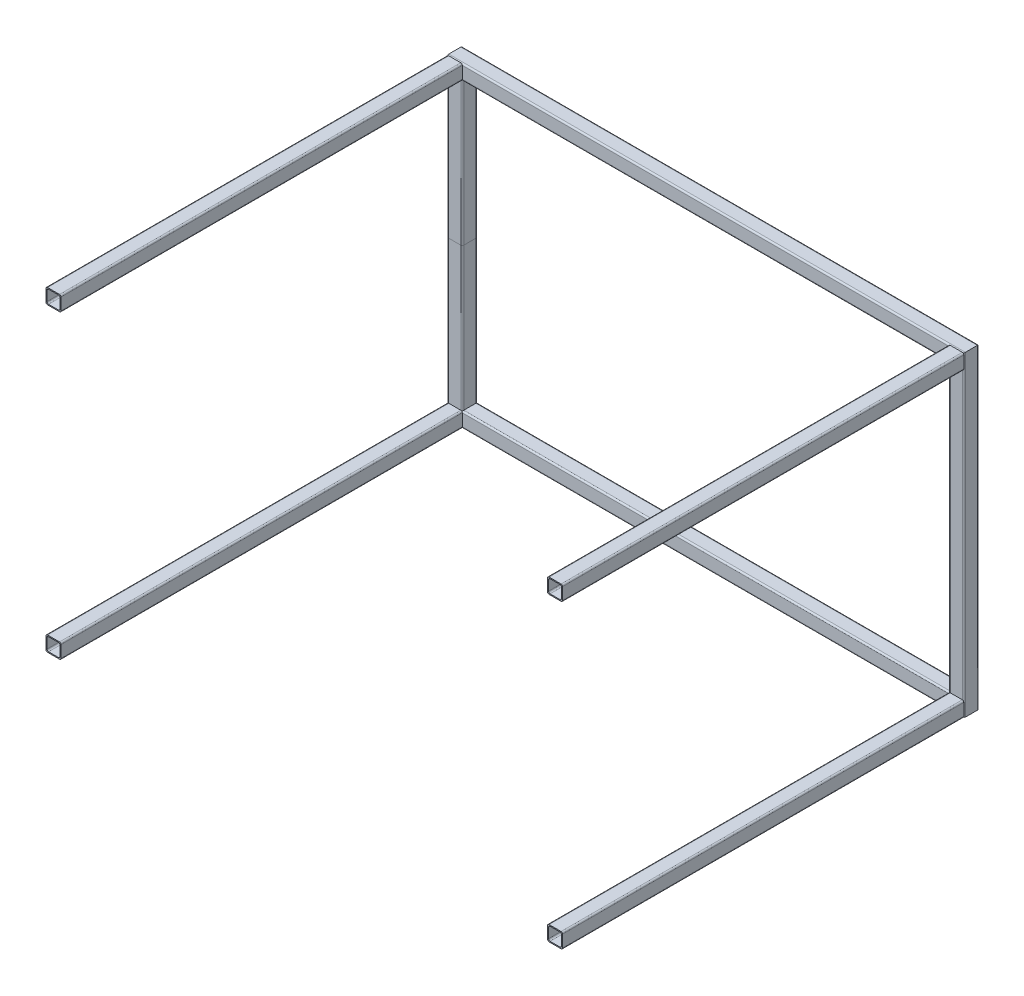
from build123d import *

# Parameters (mm, degrees)
BOSS_EXTRU_1_DEPTH = 800


with BuildPart() as part:
    # Balayage1: sweep along a path in Esquisse1
    with BuildLine(Plane.XY) as balayage1_path:
        Line((-600, -400), (600, -400))
        Line((600, -400), (600, 400))
        Line((600, 400), (-600, 400))
        Line((-600, 400), (-600, -400))
    # Esquisse2 → Balayage1 (sweep)
    with BuildSketch(Plane(origin=(0, 0, 0), x_dir=(1, 0, 0), z_dir=(0, 1, 0))):
        with BuildLine():
            Line((-512, -15), (-488, -15))
            ThreePointArc((-488, -15), (-485.878679656, -14.121320344), (-485, -12))
            Line((-485, -12), (-485, 12))
            ThreePointArc((-485, 12), (-485.878679656, 14.121320344), (-488, 15))
            Line((-488, 15), (-512, 15))
            ThreePointArc((-512, 15), (-514.121320344, 14.121320344), (-515, 12))
            Line((-515, 12), (-515, -12))
            ThreePointArc((-515, -12), (-514.121320344, -14.121320344), (-512, -15))
        make_face()
        with BuildLine():
            Line((-510, -13), (-490, -13))
            ThreePointArc((-490, -13), (-487.878679656, -12.121320344), (-487, -10))
            Line((-487, -10), (-487, 10))
            ThreePointArc((-487, 10), (-487.878679656, 12.121320344), (-490, 13))
            Line((-490, 13), (-510, 13))
            ThreePointArc((-510, 13), (-512.121320344, 12.121320344), (-513, 10))
            Line((-513, 10), (-513, -10))
            ThreePointArc((-513, -10), (-512.121320344, -12.121320344), (-510, -13))
        make_face(mode=Mode.SUBTRACT)
    sweep(path=balayage1_path.line, transition=Transition.RIGHT)

    # Esquisse3 → Boss.-Extru.1 (add)
    # profile 1 of 4: a face of its own
    with BuildSketch(Plane.XY.offset(15)):
        with BuildLine():
            Line((-512, 285), (-488, 285))
            ThreePointArc((-488, 285), (-485.878679656, 285.878679656), (-485, 288))
            Line((-485, 288), (-485, 312))
            ThreePointArc((-485, 312), (-485.878679656, 314.121320344), (-488, 315))
            Line((-488, 315), (-512, 315))
            ThreePointArc((-512, 315), (-514.121320344, 314.121320344), (-515, 312))
            Line((-515, 312), (-515, 288))
            ThreePointArc((-515, 288), (-514.121320344, 285.878679656), (-512, 285))
        make_face()
        with BuildLine():
            Line((-510, 287), (-490, 287))
            ThreePointArc((-490, 287), (-487.878679656, 287.878679656), (-487, 290))
            Line((-487, 290), (-487, 310))
            ThreePointArc((-487, 310), (-487.878679656, 312.121320344), (-490, 313))
            Line((-490, 313), (-510, 313))
            ThreePointArc((-510, 313), (-512.121320344, 312.121320344), (-513, 310))
            Line((-513, 310), (-513, 290))
            ThreePointArc((-513, 290), (-512.121320344, 287.878679656), (-510, 287))
        make_face(mode=Mode.SUBTRACT)
    # profile 2 of 4: a face of its own
    with BuildSketch(Plane.XY.offset(15)):
        with BuildLine():
            Line((485, 288), (485, 312))
            ThreePointArc((485, 312), (485.878679656, 314.121320344), (488, 315))
            Line((488, 315), (512, 315))
            ThreePointArc((512, 315), (514.121320344, 314.121320344), (515, 312))
            Line((515, 312), (515, 288))
            ThreePointArc((515, 288), (514.121320344, 285.878679656), (512, 285))
            Line((512, 285), (488, 285))
            ThreePointArc((488, 285), (485.878679656, 285.878679656), (485, 288))
        make_face()
        with BuildLine():
            Line((487, 290), (487, 310))
            ThreePointArc((487, 310), (487.878679656, 312.121320344), (490, 313))
            Line((490, 313), (510, 313))
            ThreePointArc((510, 313), (512.121320344, 312.121320344), (513, 310))
            Line((513, 310), (513, 290))
            ThreePointArc((513, 290), (512.121320344, 287.878679656), (510, 287))
            Line((510, 287), (490, 287))
            ThreePointArc((490, 287), (487.878679656, 287.878679656), (487, 290))
        make_face(mode=Mode.SUBTRACT)
    # profile 3 of 4: a face of its own
    with BuildSketch(Plane.XY.offset(15)):
        with BuildLine():
            Line((-512, -315), (-488, -315))
            ThreePointArc((-488, -315), (-485.878679656, -314.121320344), (-485, -312))
            Line((-485, -312), (-485, -288))
            ThreePointArc((-485, -288), (-485.878679656, -285.878679656), (-488, -285))
            Line((-488, -285), (-512, -285))
            ThreePointArc((-512, -285), (-514.121320344, -285.878679656), (-515, -288))
            Line((-515, -288), (-515, -312))
            ThreePointArc((-515, -312), (-514.121320344, -314.121320344), (-512, -315))
        make_face()
        with BuildLine():
            Line((-510, -287), (-490, -287))
            ThreePointArc((-490, -287), (-487.878679656, -287.878679656), (-487, -290))
            Line((-487, -290), (-487, -310))
            ThreePointArc((-487, -310), (-487.878679656, -312.121320344), (-490, -313))
            Line((-490, -313), (-510, -313))
            ThreePointArc((-510, -313), (-512.121320344, -312.121320344), (-513, -310))
            Line((-513, -310), (-513, -290))
            ThreePointArc((-513, -290), (-512.121320344, -287.878679656), (-510, -287))
        make_face(mode=Mode.SUBTRACT)
    # profile 4 of 4: a face of its own
    with BuildSketch(Plane.XY.offset(15)):
        with BuildLine():
            Line((512, -285), (488, -285))
            ThreePointArc((488, -285), (485.878679656, -285.878679656), (485, -288))
            Line((485, -288), (485, -312))
            ThreePointArc((485, -312), (485.878679656, -314.121320344), (488, -315))
            Line((488, -315), (512, -315))
            ThreePointArc((512, -315), (514.121320344, -314.121320344), (515, -312))
            Line((515, -312), (515, -288))
            ThreePointArc((515, -288), (514.121320344, -285.878679656), (512, -285))
        make_face()
        with BuildLine():
            Line((510, -287), (490, -287))
            ThreePointArc((490, -287), (487.878679656, -287.878679656), (487, -290))
            Line((487, -290), (487, -310))
            ThreePointArc((487, -310), (487.878679656, -312.121320344), (490, -313))
            Line((490, -313), (510, -313))
            ThreePointArc((510, -313), (512.121320344, -312.121320344), (513, -310))
            Line((513, -310), (513, -290))
            ThreePointArc((513, -290), (512.121320344, -287.878679656), (510, -287))
        make_face(mode=Mode.SUBTRACT)
    extrude(amount=BOSS_EXTRU_1_DEPTH)


solid = part.part
